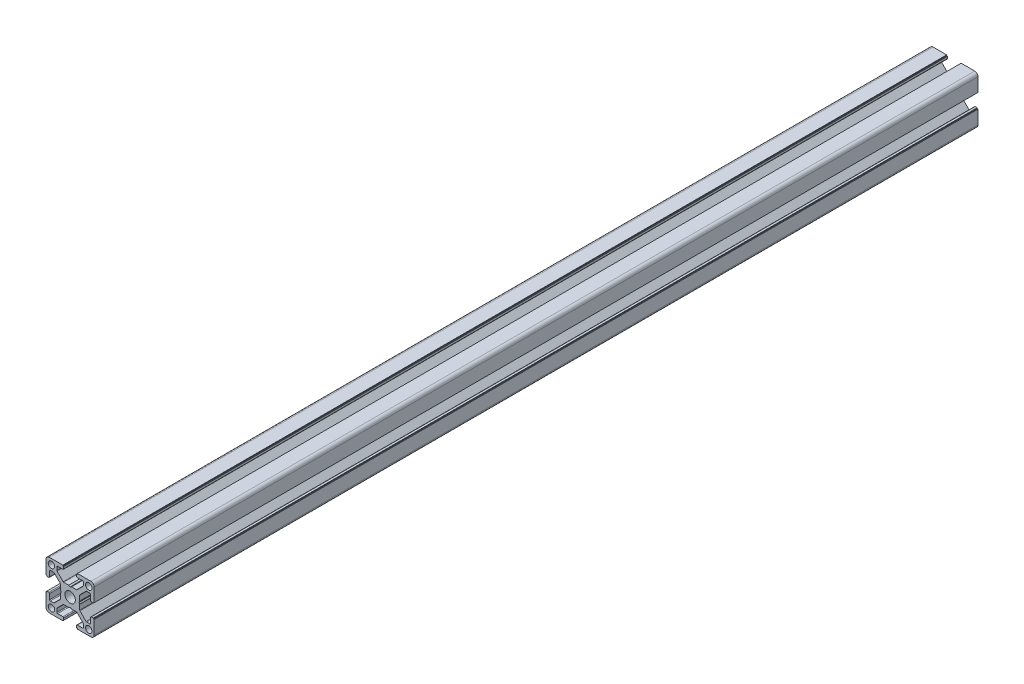
from build123d import *

# Parameters (mm, degrees)
SKETCH3_R           = 2
BOSS_EXTRUDE1_DEPTH = 275
CIRPATTERN1_COUNT   = 4


with BuildPart() as part:
    # Sketch3 → Boss-Extrude1 (new, symmetric)
    with BuildSketch(Plane.XY):
        with BuildLine():
            Line((0, 3.25), (0, 5.5))
            Line((0, 5.5), (-0.866025404, 6))
            Line((-0.866025404, 6), (-3.996841995, 6))
            ThreePointArc((-3.996841995, 6), (-4.188183711, 6.038060234), (-4.350395385, 6.146446609))
            Line((-4.350395385, 6.146446609), (-8.121053391, 9.917104615))
            ThreePointArc((-8.121053391, 9.917104615), (-8.229439766, 10.079316289), (-8.2675, 10.270658005))
            Line((-8.2675, 10.270658005), (-8.2675, 12.29))
            ThreePointArc((-8.2675, 12.29), (-8.121053391, 12.643553391), (-7.7675, 12.79))
            Line((-7.7675, 12.79), (-4.5, 12.79))
            ThreePointArc((-4.5, 12.79), (-4.146446609, 12.936446609), (-4, 13.29))
            Line((-4, 13.29), (-4, 14.5))
            Line((-4, 14.5), (-4.5, 14.5))
            Line((-4.5, 14.5), (-4.5, 15))
            Line((-4.5, 15), (-12.968, 15))
            ThreePointArc((-12.968, 15), (-14.404840979, 14.404840979), (-15, 12.968))
            Line((-15, 12.968), (-15, 4.5))
            Line((-15, 4.5), (-14.5, 4.5))
            Line((-14.5, 4.5), (-14.5, 4))
            Line((-14.5, 4), (-13.29, 4))
            ThreePointArc((-13.29, 4), (-12.936446609, 4.146446609), (-12.79, 4.5))
            Line((-12.79, 4.5), (-12.79, 7.7675))
            ThreePointArc((-12.79, 7.7675), (-12.643553391, 8.121053391), (-12.29, 8.2675))
            Line((-12.29, 8.2675), (-10.270658005, 8.2675))
            ThreePointArc((-10.270658005, 8.2675), (-10.079316289, 8.229439766), (-9.917104615, 8.121053391))
            Line((-9.917104615, 8.121053391), (-6.146446609, 4.350395385))
            ThreePointArc((-6.146446609, 4.350395385), (-6.038060234, 4.188183711), (-6, 3.996841995))
            Line((-6, 3.996841995), (-6, 0.866025404))
            Line((-6, 0.866025404), (-5.5, 0))
            Line((-5.5, 0), (-3.25, 0))
            ThreePointArc((-3.25, 0), (-3.179419121, 0.673642376), (-2.970742122, 1.318025509))
            ThreePointArc((-2.970742122, 1.318025509), (-2.298097039, 2.298097039), (-1.318025509, 2.970742122))
            ThreePointArc((-1.318025509, 2.970742122), (-0.673642376, 3.179419121), (0, 3.25))
        make_face()
        with Locations((-11.60925, 11.60925)):
            Circle(SKETCH3_R, mode=Mode.SUBTRACT)
    boss_extrude1 = extrude(amount=BOSS_EXTRUDE1_DEPTH, both=True)

    # CirPattern1: Boss-Extrude1 ×4 about axis
    cirpattern1_axis = Axis((0, 0, 0), (0, 0, 1))
    for i in range(1, CIRPATTERN1_COUNT):
        add(boss_extrude1.rotate(cirpattern1_axis, i * 360 / CIRPATTERN1_COUNT))


solid = part.part
